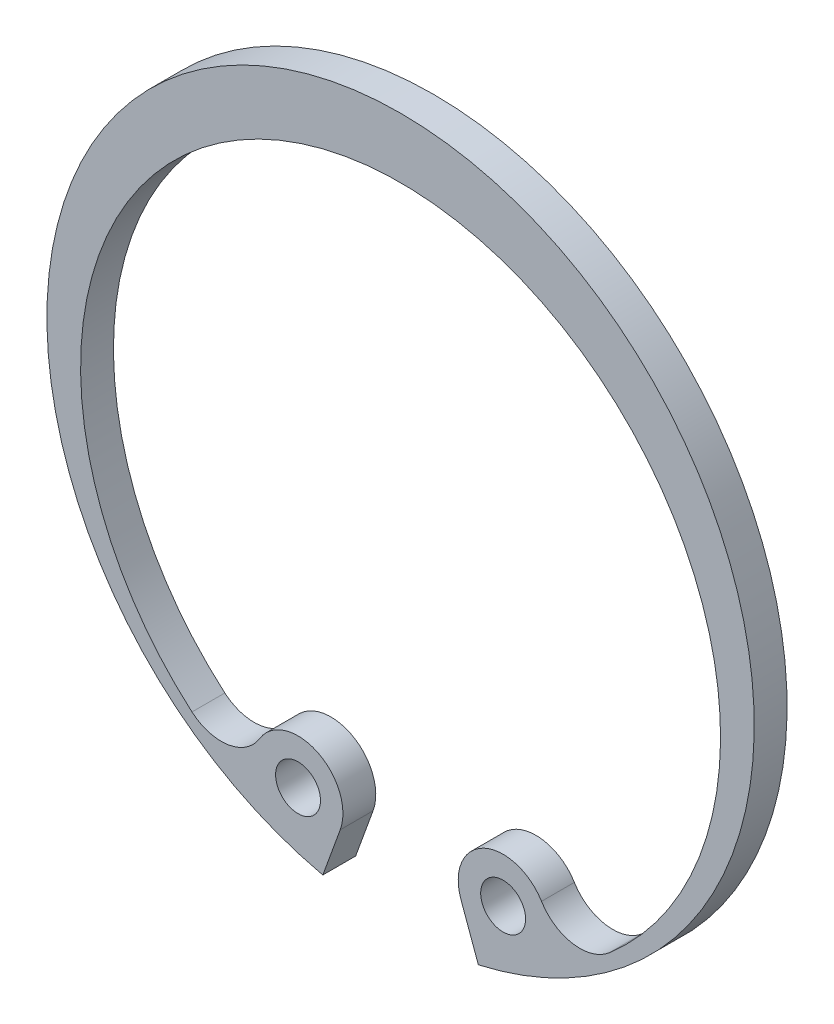
from build123d import *

# Parameters (mm, degrees)
SKETCH1_R           = 0.666666667
BOSS_EXTRUDE1_DEPTH = 0.975


with BuildPart() as part:
    # Sketch1 → Boss-Extrude1 (new body)
    with BuildSketch(Plane(origin=(0, 0, 0.975), x_dir=(-1, 0, 0), z_dir=(0, 0, -1))):
        with BuildLine():
            Line((1.791787382, -8.821301238), (2.309216253, -10.242925378))
            ThreePointArc((2.309216253, -10.242925378), (0, 10.5), (-2.309216253, -10.242925378))
            Line((-2.309216253, -10.242925378), (-1.791787382, -8.821301238))
            ThreePointArc((-1.791787382, -8.821301238), (-2.46769193, -7.163264849), (-4.184155828, -7.67285617))
            ThreePointArc((-4.184155828, -7.67285617), (-5.11466439, -8.297299138), (-6.192760092, -7.991546198))
            ThreePointArc((-6.192760092, -7.991546198), (0, 8.7126), (6.192760092, -7.991546198))
            ThreePointArc((6.192760092, -7.991546198), (5.11466439, -8.297299138), (4.184155828, -7.67285617))
            ThreePointArc((4.184155828, -7.67285617), (2.46769193, -7.163264849), (1.791787382, -8.821301238))
        make_face()
        with Locations(Location((-3.044710876, -8.36527438, 0), (0, 0, 180))):
            Circle(SKETCH1_R, mode=Mode.SUBTRACT)
        with Locations(Location((3.044710876, -8.36527438, 0), (0, 0, 180))):
            Circle(SKETCH1_R, mode=Mode.SUBTRACT)
    extrude(amount=-BOSS_EXTRUDE1_DEPTH)


solid = part.part
